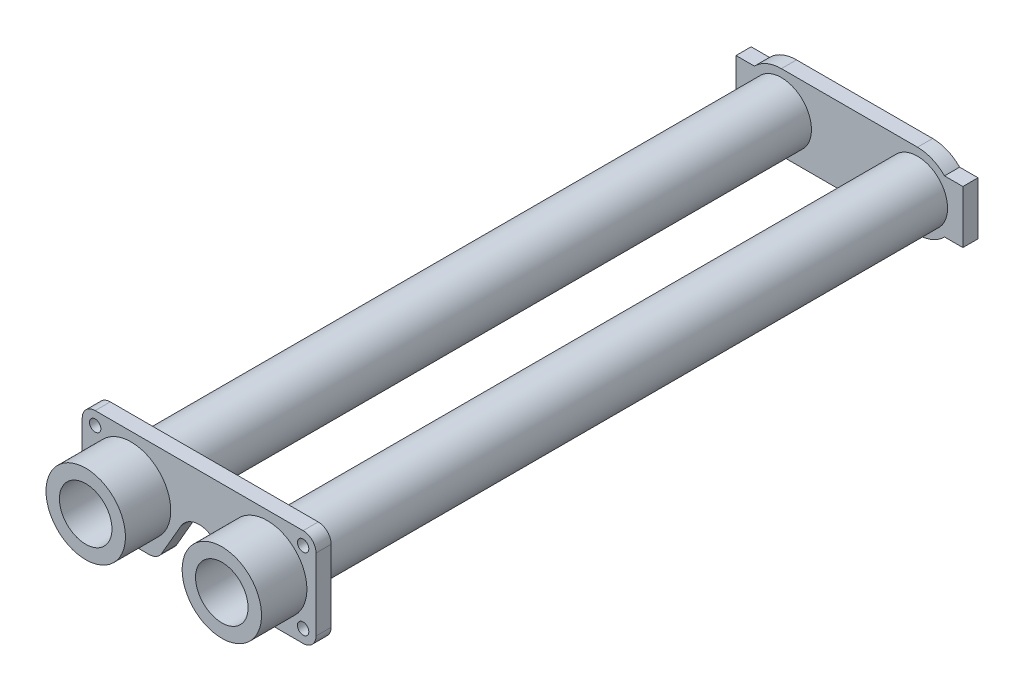
from build123d import *

# Parameters (mm, degrees)
EXTRUDE1_DEPTH      = 12.7
SKETCH27_R          = 33.3375
EXTRUDE3_DEPTH      = 38.1
SKETCH29_R          = 4.7879
SKETCH29_R_2        = 25.2349
CUT_EXTRUDE5_DEPTH  = 50.8
SKETCH41_R          = 25.2349
SKETCH41_R_2        = 22.0599
BOSS_EXTRUDE1_DEPTH = 596.9
SKETCH42_R          = 22.5679
BOSS_EXTRUDE2_DEPTH = 12.7


with BuildPart() as part:
    # Sketch1 → Extrude1 (new body)
    with BuildSketch(Plane.XY):
        with BuildLine():
            Line((-98.171, 30.1625), (-98.171, -30.1625))
            ThreePointArc((-98.171, -30.1625), (-94.990618984, -37.840618984), (-87.3125, -41.021))
            Line((-87.3125, -41.021), (-42.161003408, -41.021))
            ThreePointArc((-42.161003408, -41.021), (-35.938003408, -39.353552176), (-31.382451232, -34.798))
            Line((-31.382451232, -34.798), (-15.342939066, -7.01675))
            ThreePointArc((-15.342939066, -7.01675), (0, 1.8415), (15.342939066, -7.01675))
            Line((15.342939066, -7.01675), (31.382451232, -34.798))
            ThreePointArc((31.382451232, -34.798), (35.938003408, -39.353552176), (42.161003408, -41.021))
            Line((42.161003408, -41.021), (87.3125, -41.021))
            ThreePointArc((87.3125, -41.021), (94.990618984, -37.840618984), (98.171, -30.1625))
            Line((98.171, -30.1625), (98.171, 30.1625))
            ThreePointArc((98.171, 30.1625), (94.990618984, 37.840618984), (87.3125, 41.021))
            Line((87.3125, 41.021), (-87.3125, 41.021))
            ThreePointArc((-87.3125, 41.021), (-94.990618984, 37.840618984), (-98.171, 30.1625))
        make_face()
    extrude(amount=-EXTRUDE1_DEPTH)

    # Sketch27 → Extrude3 (add)
    with BuildSketch(Plane.XY):
        with Locations(Location((-57.15, 0, 0), (0, 0, 180))):
            Circle(SKETCH27_R)
        with Locations(Location((57.15, 0, 0), (0, 0, 180))):
            Circle(SKETCH27_R)
    extrude(amount=EXTRUDE3_DEPTH)

    # Sketch29 → Cut-Extrude5 (cut, symmetric)
    with BuildSketch(Plane.XY):
        with Locations((-87.3125, -30.1625)):
            Circle(SKETCH29_R)
        with Locations((87.3125, -30.1625)):
            Circle(SKETCH29_R)
        with Locations((87.3125, 30.1625)):
            Circle(SKETCH29_R)
        with Locations((-87.3125, 30.1625)):
            Circle(SKETCH29_R)
        with Locations((57.15, 0)):
            Circle(SKETCH29_R_2)
        with Locations((-57.15, 0)):
            Circle(SKETCH29_R_2)
    extrude(amount=CUT_EXTRUDE5_DEPTH, both=True, mode=Mode.SUBTRACT)

    # Sketch41 → Boss-Extrude1 (add)
    # profile 1 of 2: a face of its own
    with BuildSketch(Plane(origin=(0, 0, 38.1), x_dir=(-1, 0, 0), z_dir=(0, 0, -1))):
        with Locations(Location((-57.15, 0, 0), (0, 0, 180))):
            Circle(SKETCH41_R)
        with Locations((-57.15, 0)):
            Circle(SKETCH41_R_2, mode=Mode.SUBTRACT)
    # profile 2 of 2: a face of its own
    with BuildSketch(Plane(origin=(0, 0, 38.1), x_dir=(-1, 0, 0), z_dir=(0, 0, -1))):
        with Locations(Location((57.15, 0, 0), (0, 0, 180))):
            Circle(SKETCH41_R)
        with Locations((57.15, 0)):
            Circle(SKETCH41_R_2, mode=Mode.SUBTRACT)
    extrude(amount=BOSS_EXTRUDE1_DEPTH)

    # Sketch42 → Boss-Extrude2 (add)
    with BuildSketch(Plane(origin=(0, 0, -558.8), x_dir=(-1, 0, 0), z_dir=(0, 0, -1))):
        with BuildLine():
            Line((57.15, 31.75), (-57.15, 31.75))
            ThreePointArc((-57.15, 31.75), (-69.446722124, 29.272053652), (-79.824035261, 22.225))
            Line((-79.824035261, 22.225), (-95.25, 22.225))
            Line((-95.25, 22.225), (-95.25, -22.225))
            Line((-95.25, -22.225), (-79.824035261, -22.225))
            ThreePointArc((-79.824035261, -22.225), (-69.446722124, -29.272053652), (-57.15, -31.75))
            Line((-57.15, -31.75), (57.15, -31.75))
            ThreePointArc((57.15, -31.75), (69.446722124, -29.272053652), (79.824035261, -22.225))
            Line((79.824035261, -22.225), (95.25, -22.225))
            Line((95.25, -22.225), (95.25, 22.225))
            Line((95.25, 22.225), (79.824035261, 22.225))
            ThreePointArc((79.824035261, 22.225), (69.446722124, 29.272053652), (57.15, 31.75))
        make_face()
        with Locations((-57.15, 0)):
            Circle(SKETCH42_R, mode=Mode.SUBTRACT)
        with Locations((57.15, 0)):
            Circle(SKETCH42_R, mode=Mode.SUBTRACT)
    extrude(amount=-BOSS_EXTRUDE2_DEPTH)


solid = part.part
